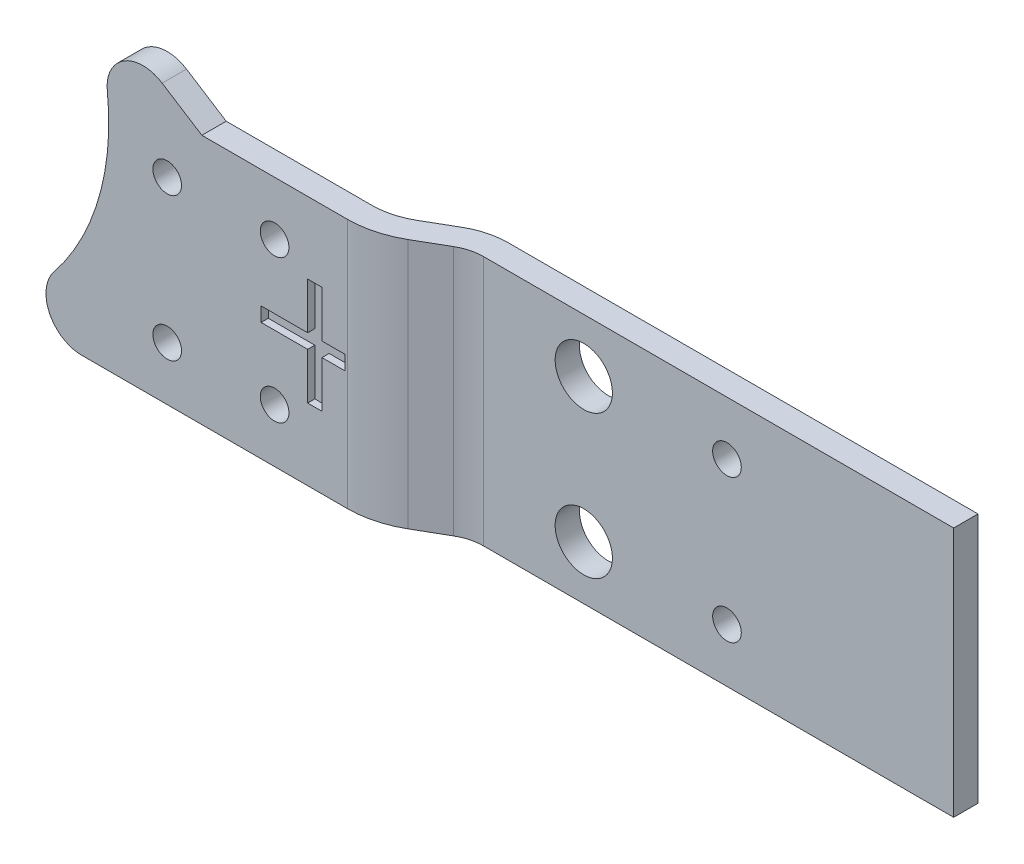
from build123d import *

# Parameters (mm, degrees)
BOSS_EXTRUDE1_DEPTH = 3.4
SKETCH3_R           = 5
CUT_EXTRUDE1_DEPTH  = 6
CUT_EXTRUDE2_DEPTH  = 10
SKETCH6_R           = 35
CUT_EXTRUDE3_DEPTH  = 10
CUT_EXTRUDE4_DEPTH  = 1
CUT_EXTRUDE5_REACH  = 87.508
SKETCH8_W           = 12
SKETCH8_H           = 35
BOSS_EXTRUDE2_DEPTH = 35
SKETCH10_R          = 4
CUT_EXTRUDE6_DEPTH  = 10
CUT_EXTRUDE7_REACH  = 153.093
SKETCH11_R          = 2
CUT_EXTRUDE8_REACH  = 153.243
SKETCH12_R          = 2
FILLET1_R           = 5


with BuildPart() as part:
    # Sketch1 → Boss-Extrude1 (new body)
    with BuildSketch(Plane.XY):
        with BuildLine():
            Line((0, -30), (80, -30))
            Line((80, -30), (80, 5))
            Line((80, 5), (48, 5))
            Line((48, 5), (16.114075804, 25.304872277))
            ThreePointArc((16.114075804, 25.304872277), (-28.802310396, 8.392074585), (0, -30))
        make_face()
    extrude(amount=BOSS_EXTRUDE1_DEPTH)

    # Sketch3 → Cut-Extrude1 (cut)
    with BuildSketch(Plane.XY.offset(3.4)):
        Circle(SKETCH3_R)
    extrude(amount=-CUT_EXTRUDE1_DEPTH, mode=Mode.SUBTRACT)

    # Sketch5 → Cut-Extrude2 (cut)
    with BuildSketch(Plane.XY.offset(3.4)):
        with BuildLine():
            ThreePointArc((0, 10), (-8.660254038, 5), (-8.660254038, -5))
            ThreePointArc((-8.660254038, -5), (-10.124355653, -10.464101615), (-15.588457268, -9))
            ThreePointArc((-15.588457268, -9), (-15.588457268, 9), (0, 18))
            ThreePointArc((0, 18), (4, 14), (0, 10))
        make_face()
    extrude(amount=-CUT_EXTRUDE2_DEPTH, mode=Mode.SUBTRACT)

    # Sketch6 → Cut-Extrude3 (cut)
    with BuildSketch(Plane(origin=(0, 0, 0), x_dir=(-1, 0, 0), z_dir=(0, 0, -1))):
        Circle(SKETCH6_R)
    extrude(amount=-CUT_EXTRUDE3_DEPTH, mode=Mode.SUBTRACT)

    # Sketch7 → Cut-Extrude4 (cut)
    with BuildSketch(Plane.XY.offset(3.4)):
        Polygon((62.77538264, -13.5), (62.77538264, -20), (64.77538264, -20), (64.77538264, -13.5), (71.27538264, -13.5), (71.27538264, -11.5), (64.77538264, -11.5), (64.77538264, -5), (62.77538264, -5), (62.77538264, -11.5), (56.27538264, -11.5), (56.27538264, -13.5), align=None)
    extrude(amount=-CUT_EXTRUDE4_DEPTH, mode=Mode.SUBTRACT)

    # Sketch8 → Cut-Extrude5 (cut, up to next)
    with BuildSketch(Plane(origin=(0, 0, 0), x_dir=(-1, 0, 0), z_dir=(0, 0, -1)), mode=Mode.PRIVATE) as cut_extrude5_sk1:
        with Locations((-74, -12.5)):
            Rectangle(SKETCH8_W, SKETCH8_H)
    cut_extrude5_tool1 = extrude(cut_extrude5_sk1.sketch, amount=-CUT_EXTRUDE5_REACH, mode=Mode.PRIVATE) & part.part
    add(cut_extrude5_tool1.solids().sort_by_distance((74, -12.5, 0))[0], mode=Mode.SUBTRACT)

    # Sketch9 → Boss-Extrude2 (add)
    with BuildSketch(Plane(origin=(0, 5, 0), x_dir=(1, 0, 0), z_dir=(0, 1, 0))):
        with BuildLine():
            Line((68, 0), (68.320508076, 0))
            ThreePointArc((68.320508076, 0), (70.908698527, 0.340741737), (73.320508076, 1.339745962))
            Line((73.320508076, 1.339745962), (77.339745962, 3.660254038))
            ThreePointArc((77.339745962, 3.660254038), (79.751555511, 4.659258263), (82.339745962, 5))
            Line((82.339745962, 5), (83, 5))
            Line((83, 5), (148, 5))
            Line((148, 5), (148, 1.6))
            Line((148, 1.6), (83, 1.6))
            Line((83, 1.6), (82.339745962, 1.6))
            ThreePointArc((82.339745962, 1.6), (80.631540264, 1.375110454), (79.039745962, 0.715767665))
            Line((79.039745962, 0.715767665), (75.020508076, -1.604740411))
            ThreePointArc((75.020508076, -1.604740411), (71.78868328, -2.943406072), (68.320508076, -3.4))
            Line((68.320508076, -3.4), (68, -3.4))
            Line((68, -3.4), (68, 0))
        make_face()
    extrude(amount=-BOSS_EXTRUDE2_DEPTH)

    # Sketch10 → Cut-Extrude6 (cut)
    with BuildSketch(Plane(origin=(0, 0, -5), x_dir=(-1, 0, 0), z_dir=(0, 0, -1))):
        with Locations((-96.339745962, -2.5)):
            Circle(SKETCH10_R)
        with Locations(Location((-96.339745962, -22.5, 0), (0, 0, 180))):
            Circle(SKETCH10_R)
    extrude(amount=-CUT_EXTRUDE6_DEPTH, mode=Mode.SUBTRACT)

    # Sketch11 → Cut-Extrude7 (cut, up to next)
    with BuildSketch(Plane(origin=(0, 0, 0), x_dir=(-1, 0, 0), z_dir=(0, 0, -1)), mode=Mode.PRIVATE) as cut_extrude7_sk1:
        with Locations((-58.160254038, -22.5)):
            Circle(SKETCH11_R)
    cut_extrude7_tool1 = extrude(cut_extrude7_sk1.sketch, amount=-CUT_EXTRUDE7_REACH, mode=Mode.PRIVATE) & part.part
    # Sketch11 → Cut-Extrude7 (cut, up to next)
    with BuildSketch(Plane(origin=(0, 0, 0), x_dir=(-1, 0, 0), z_dir=(0, 0, -1)), mode=Mode.PRIVATE) as cut_extrude7_sk2:
        with Locations((-58.160254038, -2.5)):
            Circle(SKETCH11_R)
    cut_extrude7_tool2 = extrude(cut_extrude7_sk2.sketch, amount=-CUT_EXTRUDE7_REACH, mode=Mode.PRIVATE) & part.part
    # Sketch11 → Cut-Extrude7 (cut, up to next)
    with BuildSketch(Plane(origin=(0, 0, 0), x_dir=(-1, 0, 0), z_dir=(0, 0, -1)), mode=Mode.PRIVATE) as cut_extrude7_sk3:
        with Locations((-43.160254038, -22.5)):
            Circle(SKETCH11_R)
    cut_extrude7_tool3 = extrude(cut_extrude7_sk3.sketch, amount=-CUT_EXTRUDE7_REACH, mode=Mode.PRIVATE) & part.part
    # Sketch11 → Cut-Extrude7 (cut, up to next)
    with BuildSketch(Plane(origin=(0, 0, 0), x_dir=(-1, 0, 0), z_dir=(0, 0, -1)), mode=Mode.PRIVATE) as cut_extrude7_sk4:
        with Locations((-43.160254038, -2.5)):
            Circle(SKETCH11_R)
    cut_extrude7_tool4 = extrude(cut_extrude7_sk4.sketch, amount=-CUT_EXTRUDE7_REACH, mode=Mode.PRIVATE) & part.part
    add(cut_extrude7_tool1.solids().sort_by_distance((58.160254, -22.5, 0))[0], mode=Mode.SUBTRACT)
    add(cut_extrude7_tool2.solids().sort_by_distance((58.160254, -2.5, 0))[0], mode=Mode.SUBTRACT)
    add(cut_extrude7_tool3.solids().sort_by_distance((43.160254, -22.5, 0))[0], mode=Mode.SUBTRACT)
    add(cut_extrude7_tool4.solids().sort_by_distance((43.160254, -2.5, 0))[0], mode=Mode.SUBTRACT)

    # Sketch12 → Cut-Extrude8 (cut, up to next)
    with BuildSketch(Plane(origin=(0, 0, -5), x_dir=(-1, 0, 0), z_dir=(0, 0, -1)), mode=Mode.PRIVATE) as cut_extrude8_sk1:
        with Locations((-116.339745962, -22.5)):
            Circle(SKETCH12_R)
    cut_extrude8_tool1 = extrude(cut_extrude8_sk1.sketch, amount=-CUT_EXTRUDE8_REACH, mode=Mode.PRIVATE) & part.part
    # Sketch12 → Cut-Extrude8 (cut, up to next)
    with BuildSketch(Plane(origin=(0, 0, -5), x_dir=(-1, 0, 0), z_dir=(0, 0, -1)), mode=Mode.PRIVATE) as cut_extrude8_sk2:
        with Locations((-116.339745962, -2.5)):
            Circle(SKETCH12_R)
    cut_extrude8_tool2 = extrude(cut_extrude8_sk2.sketch, amount=-CUT_EXTRUDE8_REACH, mode=Mode.PRIVATE) & part.part
    add(cut_extrude8_tool1.solids().sort_by_distance((116.339746, -22.5, -5))[0], mode=Mode.SUBTRACT)
    add(cut_extrude8_tool2.solids().sort_by_distance((116.339746, -2.5, -5))[0], mode=Mode.SUBTRACT)

    # Fillet1
    fillet1_edges = [part.edges().sort_by_distance(p)[0] for p in [
        (31.320411557, 15.621517849, 1.7),
        (18.027756377, -30, 1.7),
    ]]
    fillet(fillet1_edges, radius=FILLET1_R)


solid = part.part
